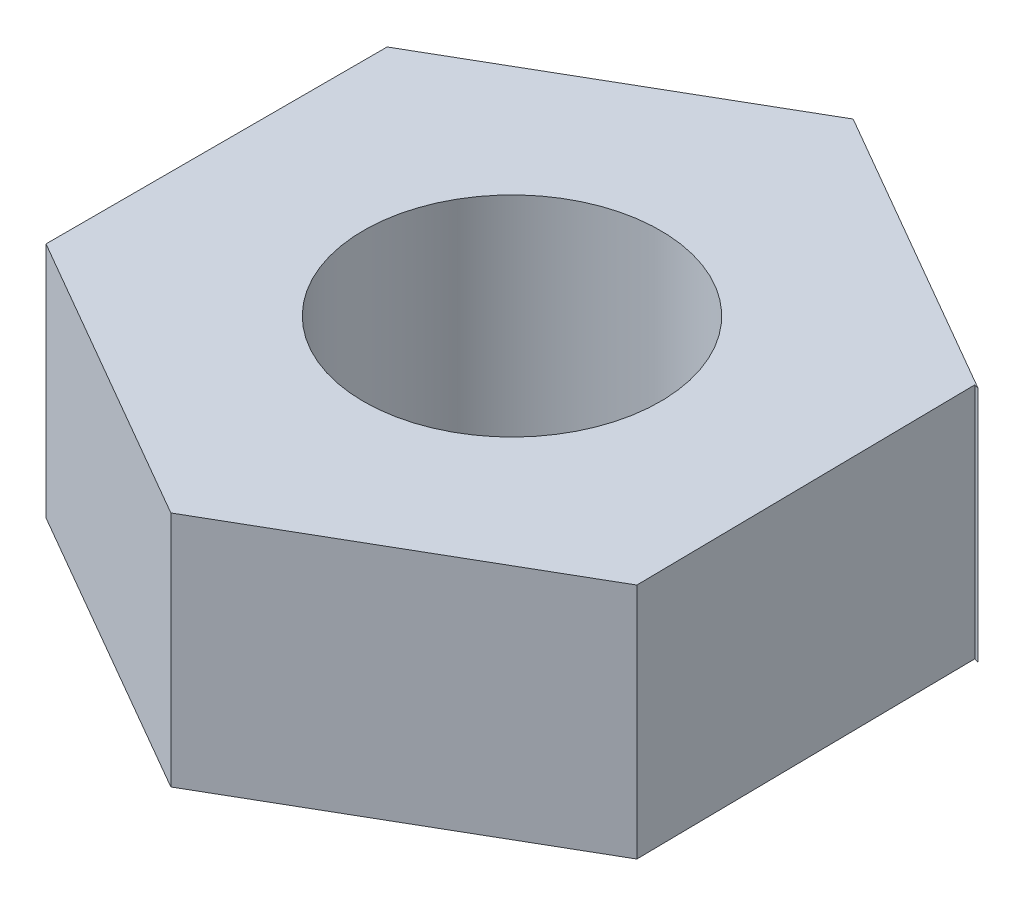
from build123d import *

# Parameters (mm, degrees)
SKETCH1_R           = 1
BOSS_EXTRUDE1_DEPTH = 1.6


with BuildPart() as part:
    # Sketch1 → Boss-Extrude1 (new body)
    with BuildSketch(Plane(origin=(0, 0, 0), x_dir=(1, 0, 0), z_dir=(0, 1, 0))):
        Polygon((0, 2.3), (-1.991858429, 1.15), (-1.991858429, -1.15), (0, -2.3), (1.991858429, -1.15), (1.962121601, 1.157885333), (1.991858429, 1.15), align=None)
        Circle(SKETCH1_R, mode=Mode.SUBTRACT)
    extrude(amount=BOSS_EXTRUDE1_DEPTH)


solid = part.part
